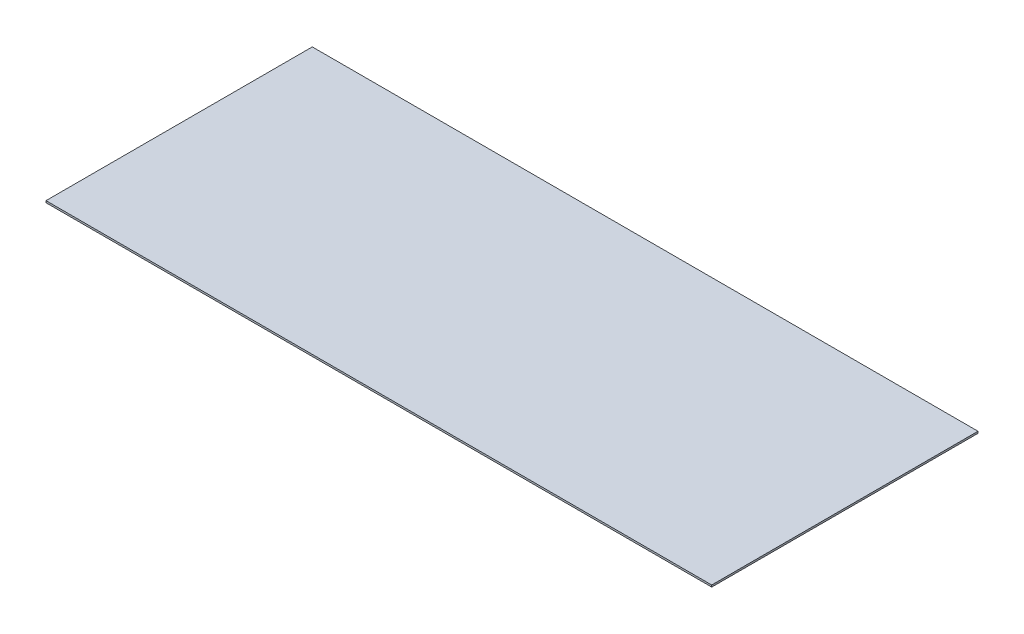
from build123d import *

# Parameters (mm, degrees)
SKETCH1_W           = 2286
SKETCH1_H           = 914.4
BOSS_EXTRUDE1_DEPTH = 6.35


with BuildPart() as part:
    # Sketch1 → Boss-Extrude1 (new body)
    with BuildSketch(Plane(origin=(0, 0, 0), x_dir=(1, 0, 0), z_dir=(0, 1, 0))):
        with Locations((1143, 457.2)):
            Rectangle(SKETCH1_W, SKETCH1_H)
    extrude(amount=BOSS_EXTRUDE1_DEPTH)


solid = part.part
